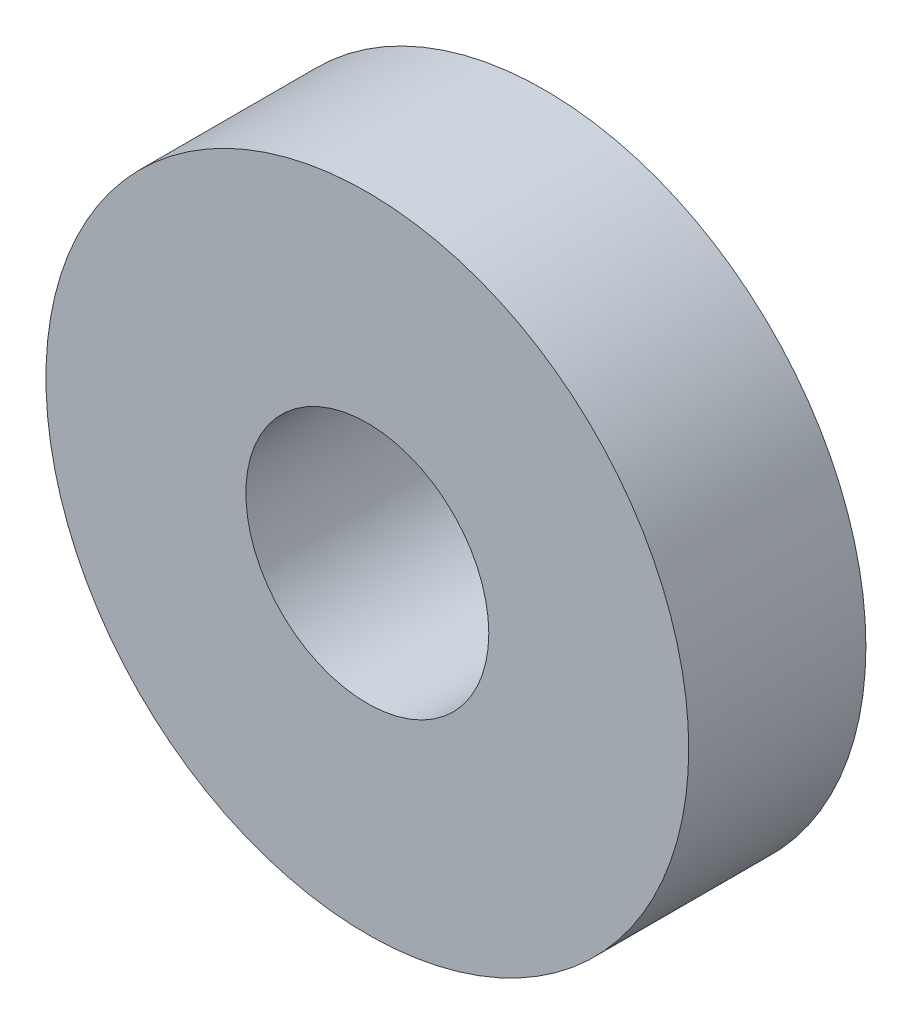
from build123d import *

# Parameters (mm, degrees)
SKETCH1_R           = 12.7
SKETCH1_R_2         = 4.8
BOSS_EXTRUDE1_DEPTH = 7


with BuildPart() as part:
    # Sketch1 → Boss-Extrude1 (new body)
    with BuildSketch(Plane.XY):
        Circle(SKETCH1_R)
        Circle(SKETCH1_R_2, mode=Mode.SUBTRACT)
    extrude(amount=BOSS_EXTRUDE1_DEPTH)


solid = part.part
